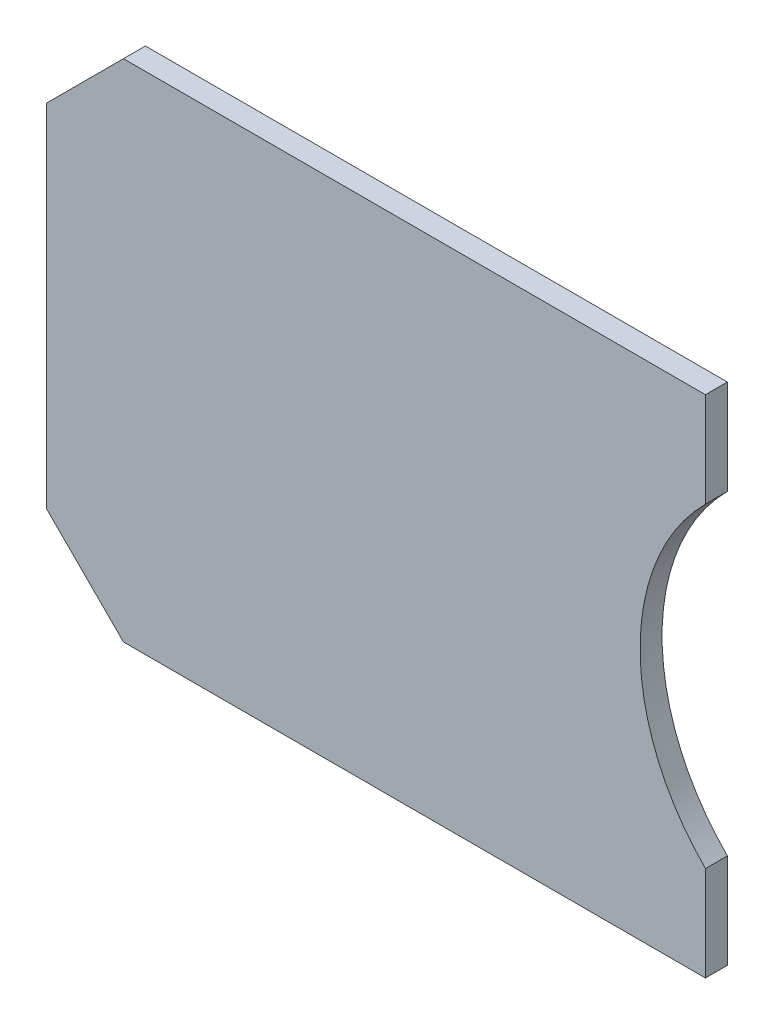
from build123d import *

# Parameters (mm, degrees)
EXTRUDE_1_DEPTH = 0.1


with BuildPart() as part:
    # Эскиз1 → Бобышка-Вытянуть1 (new body)
    with BuildSketch(Plane.XY):
        with BuildLine():
            Line((20.45, -8.849514631), (20.45, -8.418026261))
            Line((20.45, -8.418026261), (17.8, -8.418026261))
            Line((17.8, -8.418026261), (17.45, -8.768026261))
            Line((17.45, -8.768026261), (17.45, -10.368026261))
            Line((17.45, -10.368026261), (17.8, -10.718026261))
            Line((17.8, -10.718026261), (20.45, -10.718026261))
            Line((20.45, -10.718026261), (20.45, -10.286537892))
            ThreePointArc((20.45, -10.286537892), (20.152382738, -9.568026261), (20.45, -8.849514631))
        make_face()
    extrude(amount=EXTRUDE_1_DEPTH)


solid = part.part
